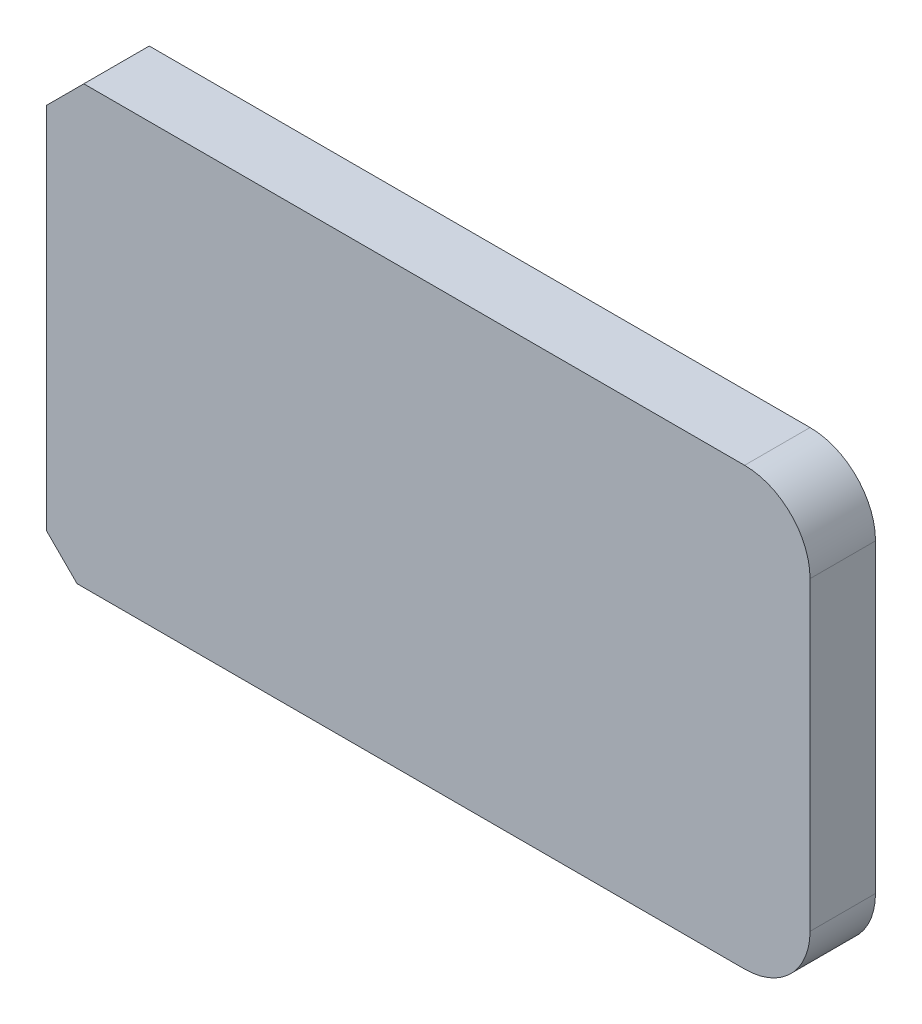
from build123d import *

# Parameters (mm, degrees)
BOSS_EXTRUDE1_DEPTH = 12


with BuildPart() as part:
    # Sketch1 → Boss-Extrude1 (new body)
    with BuildSketch(Plane.XY):
        with BuildLine():
            Line((-74.542429285, 42.512479201), (-67.701826964, 49.353081522))
            Line((-67.701826964, 49.353081522), (53.457570715, 49.353081522))
            ThreePointArc((53.457570715, 49.353081522), (61.94285209, 45.838362896), (65.457570715, 37.353081522))
            Line((65.457570715, 37.353081522), (65.457570715, -18.646918478))
            ThreePointArc((65.457570715, -18.646918478), (61.94285209, -27.132199852), (53.457570715, -30.646918478))
            Line((53.457570715, -30.646918478), (-68.937108144, -30.646918478))
            Line((-68.937108144, -30.646918478), (-74.542429285, -25.041597338))
            Line((-74.542429285, -25.041597338), (-74.542429285, 42.512479201))
        make_face()
    extrude(amount=BOSS_EXTRUDE1_DEPTH)


solid = part.part
